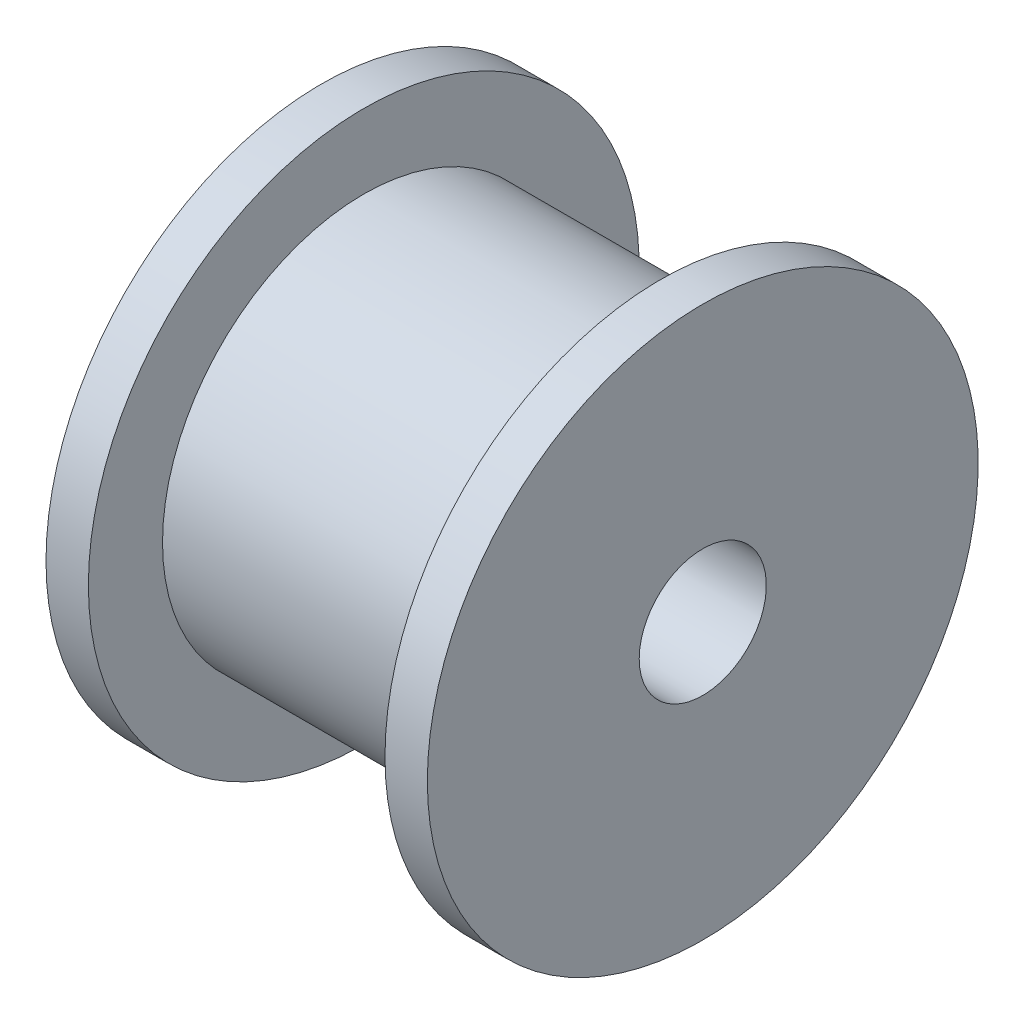
from build123d import *


with BuildPart() as part:
    # Эскиз1 → Повернуть1 (revolve)
    with BuildSketch(Plane.XY, mode=Mode.PRIVATE) as revolve_1_sk:
        Polygon((0, 4.75), (3.5, 4.75), (3.5, 6.5), (4.5, 6.5), (4.5, 1.5), (0, 1.5), (-4.5, 1.5), (-4.5, 6.5), (-3.5, 6.5), (-3.5, 4.75), align=None)
    revolve(revolve_1_sk.sketch.rotate(Axis((-12.283018868, 0, 0), (1, 0, 0)), 90), axis=Axis((-12.283018868, 0, 0), (1, 0, 0)))


solid = part.part
